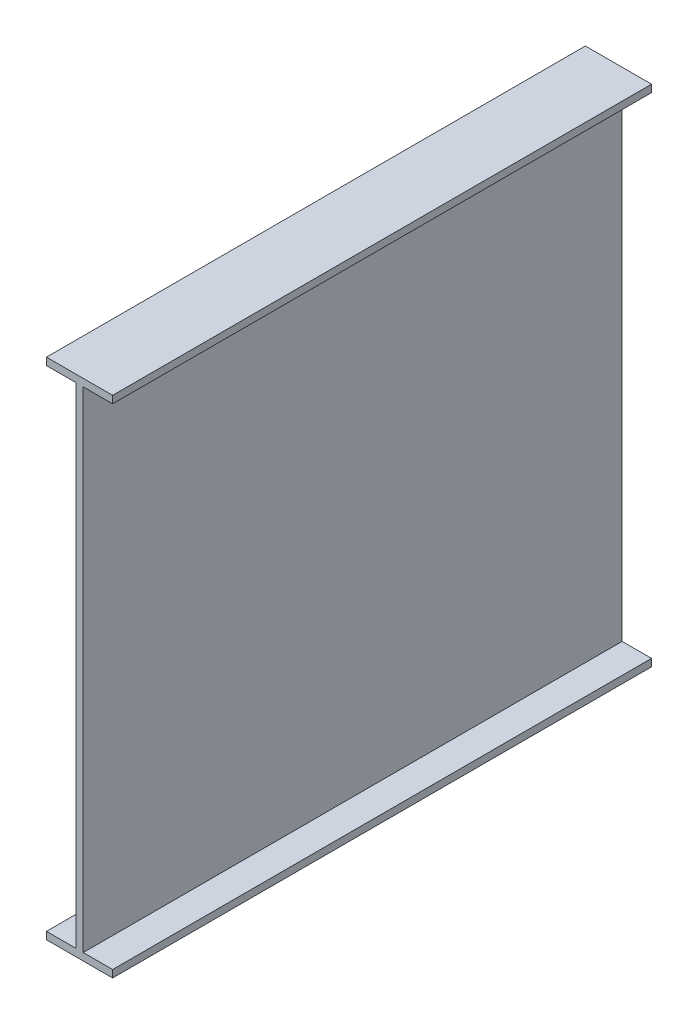
from build123d import *

# Parameters (mm, degrees)
EXTRUDE_6_DEPTH = 220


with BuildPart() as part:
    # 草图3 → 凸台-拉伸6 (new body)
    with BuildSketch(Plane.XY):
        Polygon((1.5, -100), (1.5, 100), (13.5, 100), (13.5, 103), (-1.5, 103), (-13.5, 103), (-13.5, 100), (-1.5, 100), (-1.5, -100), (-13.5, -100), (-13.5, -103), (-1.5, -103), (13.5, -103), (13.5, -100), align=None)
    extrude(amount=EXTRUDE_6_DEPTH)


solid = part.part
